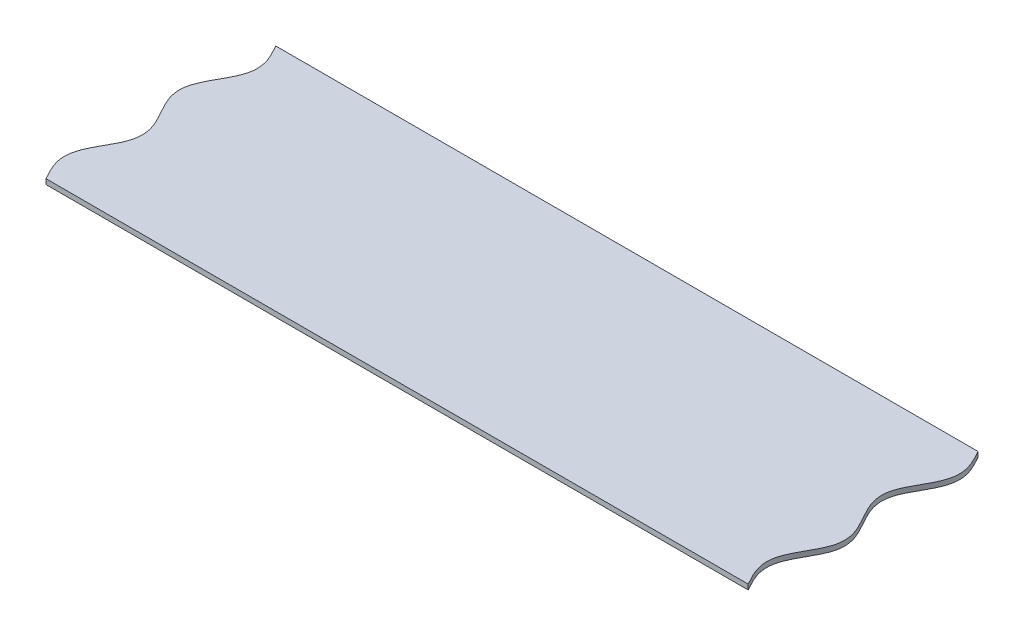
from build123d import *

# Parameters (mm, degrees)
BOSS_EXTRUDE1_DEPTH = 0.4


with BuildPart() as part:
    # Sketch1 → Boss-Extrude1 (new body)
    with BuildSketch(Plane(origin=(0, 0, 0), x_dir=(1, 0, 0), z_dir=(0, 1, 0))):
        with BuildLine():
            Line((0, 0), (55, 0))
            add(Edge.make_bspline(
                [(55, 0), (55.065049361, -0.11646358), (55.134010057, -0.239928811), (55.28408428, -0.513554698), (55.359866677, -0.668018936), (55.392965032, -0.73576023), (55.437277769, -0.827999897), (55.48986549, -0.941699093), (55.545721545, -1.072067525), (55.606481108, -1.228031763), (55.662120015, -1.390129284), (55.710583065, -1.558083652), (55.759842626, -1.771048466), (55.797912962, -2.031004964), (55.812186463, -2.425019992), (55.717858164, -3.049105165), (55.443132991, -3.714345689), (55.050822224, -4.411147032), (54.651146013, -5.1219644), (54.351444841, -5.770582127), (54.173222696, -6.468871287), (54.201416135, -7.251069142), (54.504689946, -8.14220606), (54.999945183, -9.000024025), (55.495416497, -9.857738055), (55.799660366, -10.748420045), (55.829144391, -11.530635196), (55.6518328, -12.229066273), (55.389251073, -12.798633296), (55.131315702, -13.271406551), (54.892440966, -13.696779394), (54.675203561, -14.091851892), (54.440449338, -14.577743855), (54.234710224, -15.1703876), (54.17151585, -15.751874721), (54.237844867, -16.272076235), (54.361001119, -16.690573543), (54.47697649, -16.991858427), (54.628820635, -17.312781264), (54.749235151, -17.548248531), (54.902720288, -17.825808216), (54.967475377, -17.941768149), (55, -18)],
                knots=[0.083133338, 0.083133338, 0.083133338, 0.083133338, 0.083133338, 0.110737818, 0.114188378, 0.117638938, 0.121089499, 0.124540059, 0.131441179, 0.1383423, 0.145881606, 0.153420912, 0.160960218, 0.168499524, 0.183578036, 0.198656548, 0.228813604, 0.276483315, 0.306640637, 0.336797959, 0.369388934, 0.399545925, 0.429703068, 0.469833248, 0.53014799, 0.570278163, 0.600435314, 0.6305923, 0.663183276, 0.693340599, 0.708419261, 0.723497922, 0.747332775, 0.771167627, 0.801324696, 0.831481716, 0.846560326, 0.861638936, 0.875441177, 0.889243419, 0.90304566, 0.916847902, 0.916847902, 0.916847902, 0.916847902, 0.916847902], degree=4))
            Line((55, -18), (0, -18))
            add(Edge.make_bspline(
                [(0, 0), (0.032524636, -0.05823171), (0.096732811, -0.173184303), (0.291982251, -0.526192176), (0.445208278, -0.832698965), (0.62386598, -1.244073614), (0.759592363, -1.721181667), (0.832859935, -2.251541552), (0.750726938, -2.965586954), (0.443708738, -3.715770356), (0.050478374, -4.410302839), (-0.348670519, -5.122413561), (-0.64865109, -5.770347083), (-0.826726248, -6.468996268), (-0.79861362, -7.25099649), (-0.495285138, -8.142266716), (-7.2277e-05, -8.999981493), (0.495425822, -9.857760851), (0.799655367, -10.748407976), (0.829148192, -11.530643801), (0.651829085, -12.229058369), (0.389255063, -12.798641222), (0.131311319, -13.27139837), (-0.107552618, -13.69679089), (-0.324807927, -14.091831327), (-0.559532558, -14.5777763), (-0.765316946, -15.170338553), (-0.828444311, -15.751946659), (-0.762210707, -16.271976281), (-0.638913334, -16.690727214), (-0.52318723, -16.991564482), (-0.370915545, -17.313254228), (-0.251032905, -17.547768337), (-0.097311836, -17.825750418), (-0.032524624, -17.941768148), (0, -18)],
                knots=[0.083133342, 0.083133342, 0.083133342, 0.083133342, 0.083133342, 0.096935577, 0.110737818, 0.1383423, 0.153420912, 0.168499524, 0.198656548, 0.228813604, 0.276483315, 0.306640637, 0.336797959, 0.369388934, 0.399545924, 0.429703068, 0.469833247, 0.53014799, 0.570278162, 0.600435313, 0.6305923, 0.663183276, 0.693340599, 0.708419261, 0.723497922, 0.747332775, 0.771167627, 0.801324696, 0.831481716, 0.846560326, 0.861638936, 0.875441177, 0.889243419, 0.90304566, 0.916847902, 0.916847902, 0.916847902, 0.916847902, 0.916847902], degree=4))
        make_face()
    extrude(amount=BOSS_EXTRUDE1_DEPTH)


solid = part.part
